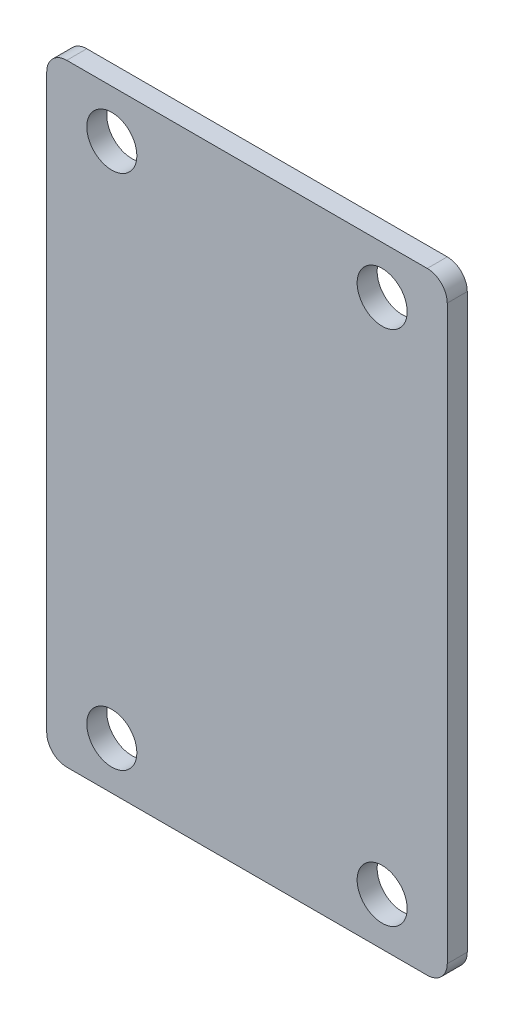
from build123d import *

# Parameters (mm, degrees)
SKETCH1_R           = 1.25
BOSS_EXTRUDE1_DEPTH = 1


with BuildPart() as part:
    # Sketch1 → Boss-Extrude1 (new body)
    with BuildSketch(Plane.XY):
        with BuildLine():
            Line((0, 14.283660896), (0, -7.246695314))
            Line((0, -7.246695314), (0, -14.283660896))
            ThreePointArc((0, -14.283660896), (-0.292893219, -14.990767678), (-1, -15.283660896))
            Line((-1, -15.283660896), (-19, -15.283660896))
            ThreePointArc((-19, -15.283660896), (-19.707106781, -14.990767678), (-20, -14.283660896))
            Line((-20, -14.283660896), (-20, -7.246695314))
            Line((-20, -7.246695314), (-20, 14.283660896))
            ThreePointArc((-20, 14.283660896), (-19.707106781, 14.990767678), (-19, 15.283660896))
            Line((-19, 15.283660896), (-1, 15.283660896))
            ThreePointArc((-1, 15.283660896), (-0.292893219, 14.990767678), (0, 14.283660896))
        make_face()
        with Locations((-16.75, -12.908028273)):
            Circle(SKETCH1_R, mode=Mode.SUBTRACT)
        with Locations((-3.25, -12.908028273)):
            Circle(SKETCH1_R, mode=Mode.SUBTRACT)
        with Locations((-3.25, 12.908028273)):
            Circle(SKETCH1_R, mode=Mode.SUBTRACT)
        with Locations((-16.75, 12.908028273)):
            Circle(SKETCH1_R, mode=Mode.SUBTRACT)
    extrude(amount=BOSS_EXTRUDE1_DEPTH)


solid = part.part
